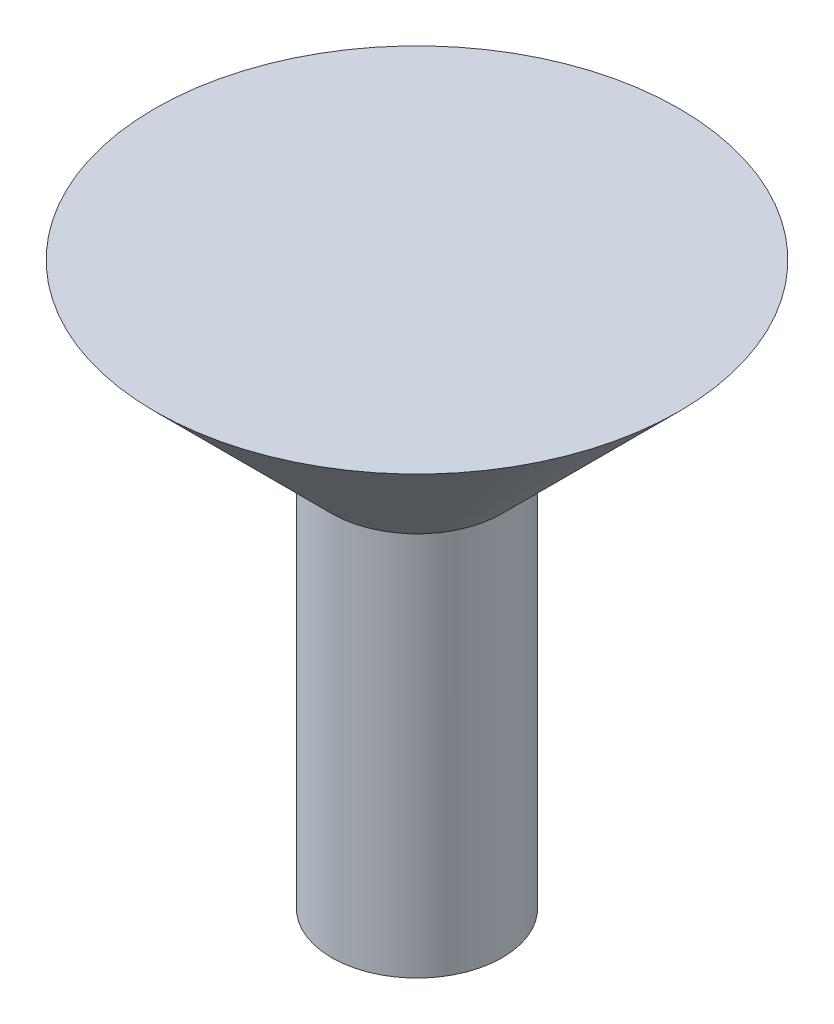
from build123d import *

# Parameters (mm, degrees)
SKETCH2_R           = 2.217157288
BOSS_EXTRUDE1_DEPTH = 10
SKETCH3_R           = 1.5
BOSS_EXTRUDE2_DEPTH = 3
SKETCH3_2_R         = 1.5
CUT_EXTRUDE1_DEPTH  = 5


with BuildPart() as part:
    # Sketch1 → Revolve1 (revolve)
    with BuildSketch(Plane.XY):
        Polygon((-0.2, 2.3), (-0.2, -2.3), (-2.417157288, -2.3), (-7.017157288, 2.3), align=None)
    revolve(axis=Axis((-0.2, 2.3, 0), (0, -1, 0)))

    # Sketch2 → Boss-Extrude1 (add)
    with BuildSketch(Plane.XZ.offset(2.3)):
        with Locations((-0.2, 0)):
            Circle(SKETCH2_R)
    extrude(amount=BOSS_EXTRUDE1_DEPTH)

    # Sketch3 → Boss-Extrude2 (add)
    with BuildSketch(Plane.XZ.offset(12.3)):
        with Locations((-0.2, 0)):
            Circle(SKETCH3_R)
    extrude(amount=-BOSS_EXTRUDE2_DEPTH)

    # Sketch3<2> → Cut-Extrude1 (cut)
    with BuildSketch(Plane.XZ.offset(12.3)):
        with Locations((-0.2, 0)):
            Circle(SKETCH3_2_R)
    extrude(amount=-CUT_EXTRUDE1_DEPTH, mode=Mode.SUBTRACT)


solid = part.part
